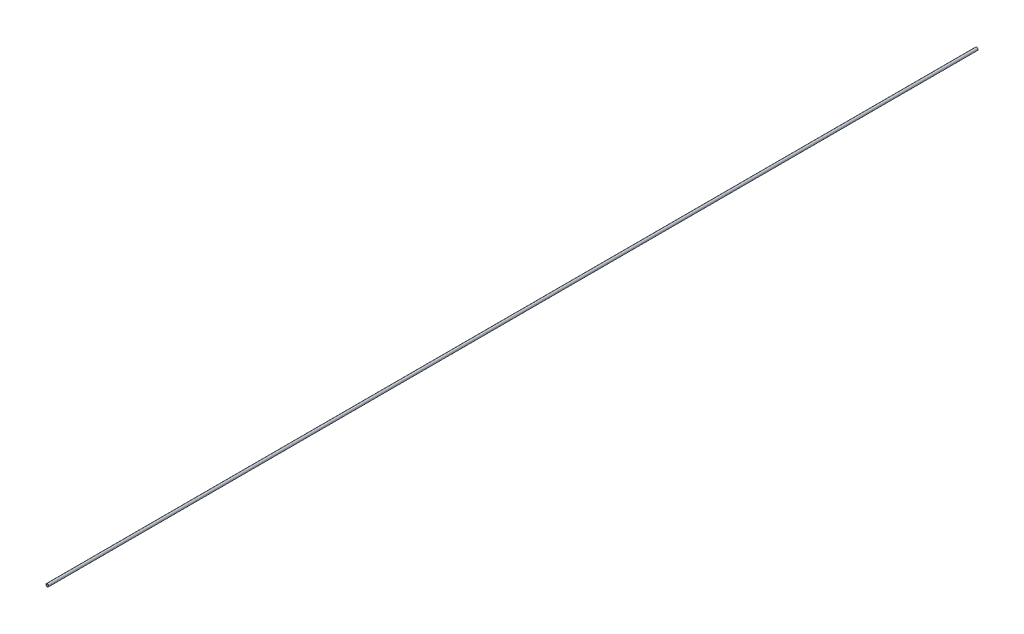
from build123d import *

# Parameters (mm, degrees)
PROFILES_R    = 1.5
PROFILES_R_2  = 1
PROFILE_DEPTH = 502.5


with BuildPart() as part:
    # ProfileS → Profile (new, symmetric)
    with BuildSketch(Plane.XY):
        Circle(PROFILES_R)
        Circle(PROFILES_R_2, mode=Mode.SUBTRACT)
    extrude(amount=PROFILE_DEPTH, both=True)


solid = part.part
